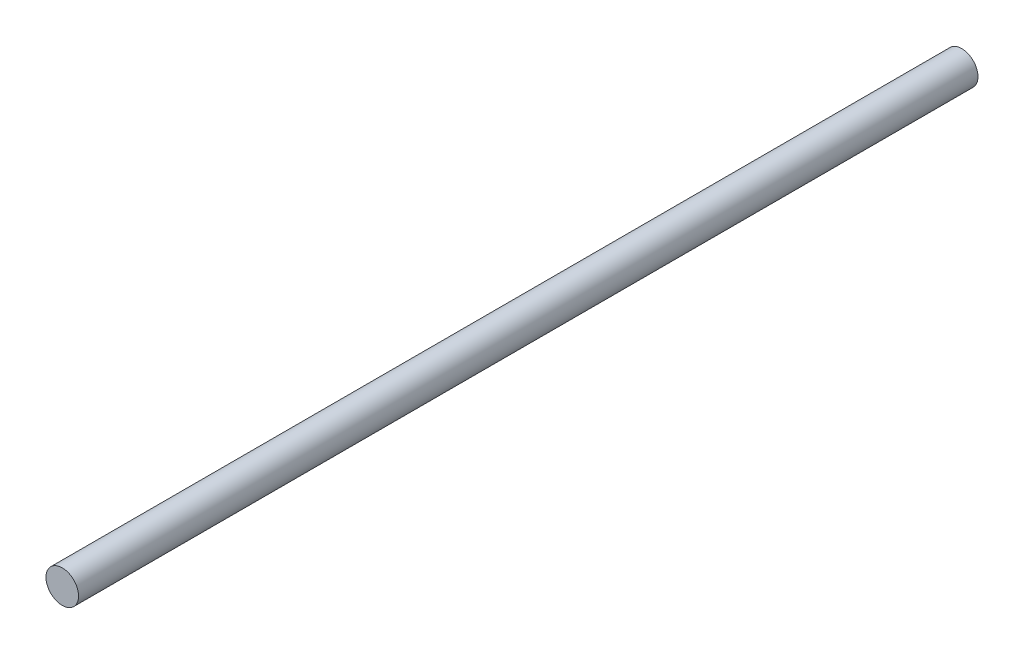
from build123d import *

# Parameters (mm, degrees)
SKETCH1_R           = 3.175
BOSS_EXTRUDE1_DEPTH = 175.26


with BuildPart() as part:
    # Sketch1 → Boss-Extrude1 (new body)
    with BuildSketch(Plane.XY):
        Circle(SKETCH1_R)
    extrude(amount=BOSS_EXTRUDE1_DEPTH)


solid = part.part
